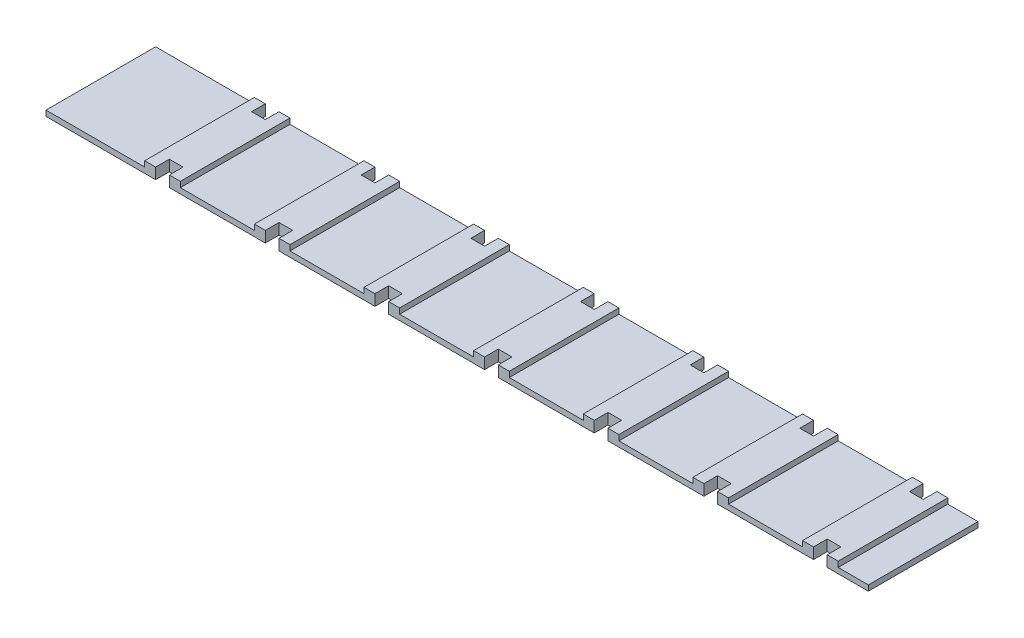
from build123d import *

# Parameters (mm, degrees)
BOSS_EXTRUDE1_DEPTH = 1
BOSS_EXTRUDE2_DEPTH = 1


with BuildPart() as part:
    # Sketch1 → Boss-Extrude1 (new body)
    with BuildSketch(Plane(origin=(0, 0, 0), x_dir=(1, 0, 0), z_dir=(0, 1, 0))):
        Polygon((40, 0), (40, 2.5), (42.5, 2.5), (42.5, 0), (60, 0), (60, 2.5), (62.5, 2.5), (62.5, 0), (80, 0), (80, 2.5), (82.5, 2.5), (82.5, 0), (100, 0), (100, 2.5), (102.5, 2.5), (102.5, 0), (120, 0), (120, 2.5), (122.5, 2.5), (122.5, 0), (140, 0), (140, 2.5), (142.5, 2.5), (142.5, 0), (150, 0), (150, 20), (142.5, 20), (142.5, 17.5), (140, 17.5), (140, 20), (122.5, 20), (122.5, 17.5), (120, 17.5), (120, 20), (102.5, 20), (102.5, 17.5), (100, 17.5), (100, 20), (82.5, 20), (82.5, 17.5), (80, 17.5), (80, 20), (62.5, 20), (62.5, 17.5), (60, 17.5), (60, 20), (42.5, 20), (42.5, 17.5), (40, 17.5), (40, 20), (22.5, 20), (22.5, 17.5), (20, 17.5), (20, 20), (0, 20), (0, 0), (20, 0), (20, 2.5), (22.5, 2.5), (22.5, 0), align=None)
    extrude(amount=BOSS_EXTRUDE1_DEPTH)

    # Sketch2 → Boss-Extrude2 (add)
    with BuildSketch(Plane(origin=(0, 1, 0), x_dir=(1, 0, 0), z_dir=(0, 1, 0))):
        Polygon((20, 20), (18, 20), (18, 0), (20, 0), (20, 2.5), (22.5, 2.5), (22.5, 0), (24.5, 0), (24.5, 20), (22.5, 20), (22.5, 17.5), (20, 17.5), align=None)
        Polygon((40, 17.5), (40, 20), (38, 20), (38, 0), (40, 0), (40, 2.5), (42.5, 2.5), (42.5, 0), (44.5, 0), (44.5, 20), (42.5, 20), (42.5, 17.5), align=None)
        Polygon((60, 17.5), (60, 20), (58, 20), (58, 0), (60, 0), (60, 2.5), (62.5, 2.5), (62.5, 0), (64.5, 0), (64.5, 20), (62.5, 20), (62.5, 17.5), align=None)
        Polygon((80, 17.5), (80, 20), (78, 20), (78, 0), (80, 0), (80, 2.5), (82.5, 2.5), (82.5, 0), (84.5, 0), (84.5, 20), (82.5, 20), (82.5, 17.5), align=None)
        Polygon((100, 17.5), (100, 20), (98, 20), (98, 0), (100, 0), (100, 2.5), (102.5, 2.5), (102.5, 0), (104.5, 0), (104.5, 20), (102.5, 20), (102.5, 17.5), align=None)
        Polygon((120, 17.5), (120, 20), (118, 20), (118, 0), (120, 0), (120, 2.5), (122.5, 2.5), (122.5, 0), (124.5, 0), (124.5, 20), (122.5, 20), (122.5, 17.5), align=None)
        Polygon((140, 17.5), (140, 20), (138, 20), (138, 0), (140, 0), (140, 2.5), (142.5, 2.5), (142.5, 0), (144.5, 0), (144.5, 20), (142.5, 20), (142.5, 17.5), align=None)
    extrude(amount=BOSS_EXTRUDE2_DEPTH)


solid = part.part
